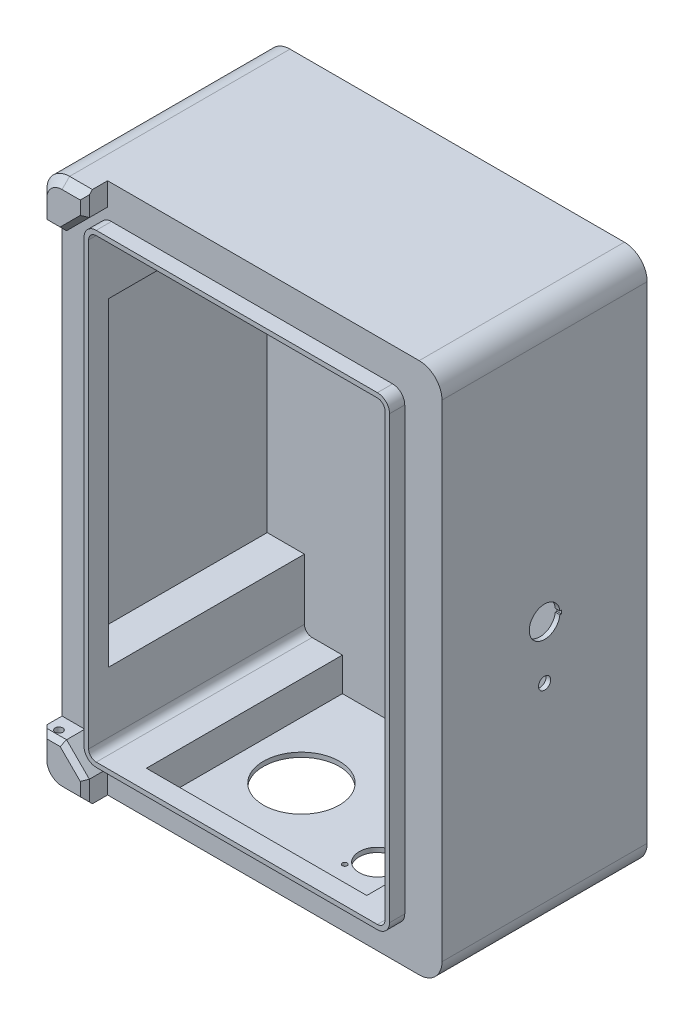
from build123d import *

# Parameters (mm, degrees)
BOSS_EXTRUDE1_DEPTH     = 3
BOSS_EXTRUDE2_DEPTH     = 132
CUT_EXTRUDE1_DEPTH      = 219.5
CUT_EXTRUDE1_DEPTH_BACK = 24.5
SKETCH3_W               = 129
SKETCH3_H               = 210
CUT_EXTRUDE2_DEPTH      = 322
CUT_EXTRUDE2_DEPTH_BACK = 22
SKETCH5_W               = 145
SKETCH5_H               = 129
BOSS_EXTRUDE3_DEPTH     = 10
BOSS_EXTRUDE4_DEPTH     = 15
CHAMFER1_SIZE           = 5
CHAMFER2_SIZE           = 3
CUT_EXTRUDE3_DEPTH      = 295
CUT_EXTRUDE3_DEPTH_BACK = 5
SKETCH10_R              = 2.5
SKETCH11_R              = 12
SKETCH11_R_2            = 7.6
SKETCH11_R_3            = 25
SKETCH11_R_4            = 1.6
CUT_EXTRUDE4_DEPTH      = 10
SKETCH13_R              = 4
CUT_EXTRUDE6_DEPTH      = 10


with BuildPart() as part:
    # Sketch1 → Boss-Extrude1 (new body)
    with BuildSketch(Plane.XY):
        with BuildLine():
            Line((15, 0), (235, 0))
            ThreePointArc((235, 0), (245.606601718, 4.393398282), (250, 15))
            Line((250, 15), (250, 335))
            ThreePointArc((250, 335), (245.606601718, 345.606601718), (235, 350))
            Line((235, 350), (15, 350))
            ThreePointArc((15, 350), (4.393398282, 345.606601718), (0, 335))
            Line((0, 335), (0, 15))
            ThreePointArc((0, 15), (4.393398282, 4.393398282), (15, 0))
        make_face()
    extrude(amount=BOSS_EXTRUDE1_DEPTH)

    # Sketch2 → Boss-Extrude2 (add)
    with BuildSketch(Plane.XY.offset(3)):
        with BuildLine():
            Line((0, 335), (0, 15))
            ThreePointArc((0, 15), (4.393398282, 4.393398282), (15, 0))
            Line((15, 0), (235, 0))
            ThreePointArc((235, 0), (245.606601718, 4.393398282), (250, 15))
            Line((250, 15), (250, 335))
            ThreePointArc((250, 335), (245.606601718, 345.606601718), (235, 350))
            Line((235, 350), (15, 350))
            ThreePointArc((15, 350), (4.393398282, 345.606601718), (0, 335))
        make_face()
        with BuildLine():
            ThreePointArc((32.5, 325), (28.964466094, 323.535533906), (27.5, 320))
            Line((27.5, 320), (27.5, 30))
            ThreePointArc((27.5, 30), (28.964466094, 26.464466094), (32.5, 25))
            Line((32.5, 25), (217.5, 25))
            ThreePointArc((217.5, 25), (221.035533906, 26.464466094), (222.5, 30))
            Line((222.5, 30), (222.5, 320))
            ThreePointArc((222.5, 320), (221.035533906, 323.535533906), (217.5, 325))
            Line((217.5, 325), (32.5, 325))
        make_face(mode=Mode.SUBTRACT)
    extrude(amount=BOSS_EXTRUDE2_DEPTH)

    # Sketch3 → Cut-Extrude1 (cut, two sides: drawn at the far end of the back side and taken through both)
    with BuildSketch(Plane(origin=(27.5, 0, 0), x_dir=(0, 0, -1), z_dir=(1, 0, 0)).offset(-CUT_EXTRUDE1_DEPTH_BACK)):
        with Locations((-67.5, 175)):
            Rectangle(SKETCH3_W, SKETCH3_H)
    extrude(amount=CUT_EXTRUDE1_DEPTH + CUT_EXTRUDE1_DEPTH_BACK, mode=Mode.SUBTRACT)

    # Sketch5 → Cut-Extrude2 (cut, two sides: drawn at the far end of the back side and taken through both)
    with BuildSketch(Plane(origin=(0, 25, 0), x_dir=(1, 0, 0), z_dir=(0, 1, 0)).offset(-CUT_EXTRUDE2_DEPTH_BACK)):
        with Locations((125, -67.5)):
            Rectangle(SKETCH5_W, SKETCH5_H)
    extrude(amount=CUT_EXTRUDE2_DEPTH + CUT_EXTRUDE2_DEPTH_BACK, mode=Mode.SUBTRACT)

    # Sketch8 → Boss-Extrude3 (add)
    with BuildSketch(Plane.XY.offset(135)):
        with BuildLine():
            Line((225.5, 30), (225.5, 320))
            ThreePointArc((225.5, 320), (223.156854249, 325.656854249), (217.5, 328))
            Line((217.5, 328), (32.5, 328))
            ThreePointArc((32.5, 328), (26.843145751, 325.656854249), (24.5, 320))
            Line((24.5, 320), (24.5, 30))
            ThreePointArc((24.5, 30), (26.843145751, 24.343145751), (32.5, 22))
            Line((32.5, 22), (217.5, 22))
            ThreePointArc((217.5, 22), (223.156854249, 24.343145751), (225.5, 30))
        make_face()
        with BuildLine():
            Line((32.5, 25), (217.5, 25))
            ThreePointArc((217.5, 25), (221.035533906, 26.464466094), (222.5, 30))
            Line((222.5, 30), (222.5, 320))
            ThreePointArc((222.5, 320), (221.035533906, 323.535533906), (217.5, 325))
            Line((217.5, 325), (32.5, 325))
            ThreePointArc((32.5, 325), (28.964466094, 323.535533906), (27.5, 320))
            Line((27.5, 320), (27.5, 30))
            ThreePointArc((27.5, 30), (28.964466094, 26.464466094), (32.5, 25))
        make_face(mode=Mode.SUBTRACT)
    extrude(amount=BOSS_EXTRUDE3_DEPTH)

    # Sketch9 → Boss-Extrude4 (add)
    with BuildSketch(Plane.XY.offset(135)):
        with BuildLine():
            ThreePointArc((0, 15), (4.393398282, 4.393398282), (15, 0))
            Line((15, 0), (30, 0))
            Line((30, 0), (30, 15))
            Line((30, 15), (15, 30))
            Line((15, 30), (0, 30))
            Line((0, 30), (0, 15))
        make_face()
        with BuildLine():
            Line((0, 335), (0, 320))
            Line((0, 320), (15, 320))
            Line((15, 320), (30, 335))
            Line((30, 335), (30, 350))
            Line((30, 350), (15, 350))
            ThreePointArc((15, 350), (4.393398282, 345.606601718), (0, 335))
        make_face()
    extrude(amount=BOSS_EXTRUDE4_DEPTH)

    # Chamfer1
    chamfer1_edges = [part.edges().sort_by_distance(p)[0] for p in [
        (0, 22.5, 150),
        (4.393398282, 4.393398282, 150),
        (22.5, 0, 150),
        (22.5, 350, 150),
        (4.393398282, 345.606601718, 150),
        (0, 327.5, 150),
    ]]
    chamfer(chamfer1_edges, length=CHAMFER1_SIZE)

    # Chamfer2
    chamfer2_edges = [part.edges().sort_by_distance(p)[0] for p in [
        (30, 10, 150),
        (22.5, 22.5, 150),
        (22.5, 327.5, 150),
        (30, 340, 150),
        (10, 30, 150),
        (10, 320, 150),
    ]]
    chamfer(chamfer2_edges, length=CHAMFER2_SIZE)

    # Sketch10 → Cut-Extrude3 (cut, two sides: drawn at the far end of the back side and taken through both)
    with BuildSketch(Plane(origin=(0, 30, 0), x_dir=(1, 0, 0), z_dir=(0, 1, 0)).offset(-CUT_EXTRUDE3_DEPTH_BACK)):
        with Locations(Location((7, -144, 0), (0, 0, 270))):
            Circle(SKETCH10_R)
    extrude(amount=CUT_EXTRUDE3_DEPTH + CUT_EXTRUDE3_DEPTH_BACK, mode=Mode.SUBTRACT)

    # Sketch11 → Cut-Extrude4 (cut)
    with BuildSketch(Plane(origin=(0, 3, 0), x_dir=(1, 0, 0), z_dir=(0, 1, 0))):
        with Locations(Location((160, -87.5, 0), (0, 0, 270))):
            Circle(SKETCH11_R)
        with Locations(Location((145, -47.5, 0), (0, 0, 270))):
            Circle(SKETCH11_R_2)
        with Locations(Location((175, -47.5, 0), (0, 0, 270))):
            Circle(SKETCH11_R_2)
        with Locations(Location((90, -67.5, 0), (0, 0, 270))):
            Circle(SKETCH11_R_3)
        with Locations(Location((150.5, -99.5, 0), (0, 0, 270))):
            Circle(SKETCH11_R_4)
        with Locations(Location((169.5, -75.5, 0), (0, 0, 270))):
            Circle(SKETCH11_R_4)
    extrude(amount=-CUT_EXTRUDE4_DEPTH, mode=Mode.SUBTRACT)

    # Sketch13 → Cut-Extrude6 (cut)
    with BuildSketch(Plane.ZY.offset(-247)):
        with Locations((67.5, 140)):
            Circle(SKETCH13_R)
        with BuildLine():
            Line((57.460079682, 173.9), (56.5, 173.9))
            Line((56.5, 173.9), (56.5, 176.1))
            Line((56.5, 176.1), (57.460079682, 176.1))
            ThreePointArc((57.460079682, 176.1), (77.6, 175), (57.460079682, 173.9))
        make_face()
    extrude(amount=-CUT_EXTRUDE6_DEPTH, mode=Mode.SUBTRACT)


solid = part.part
